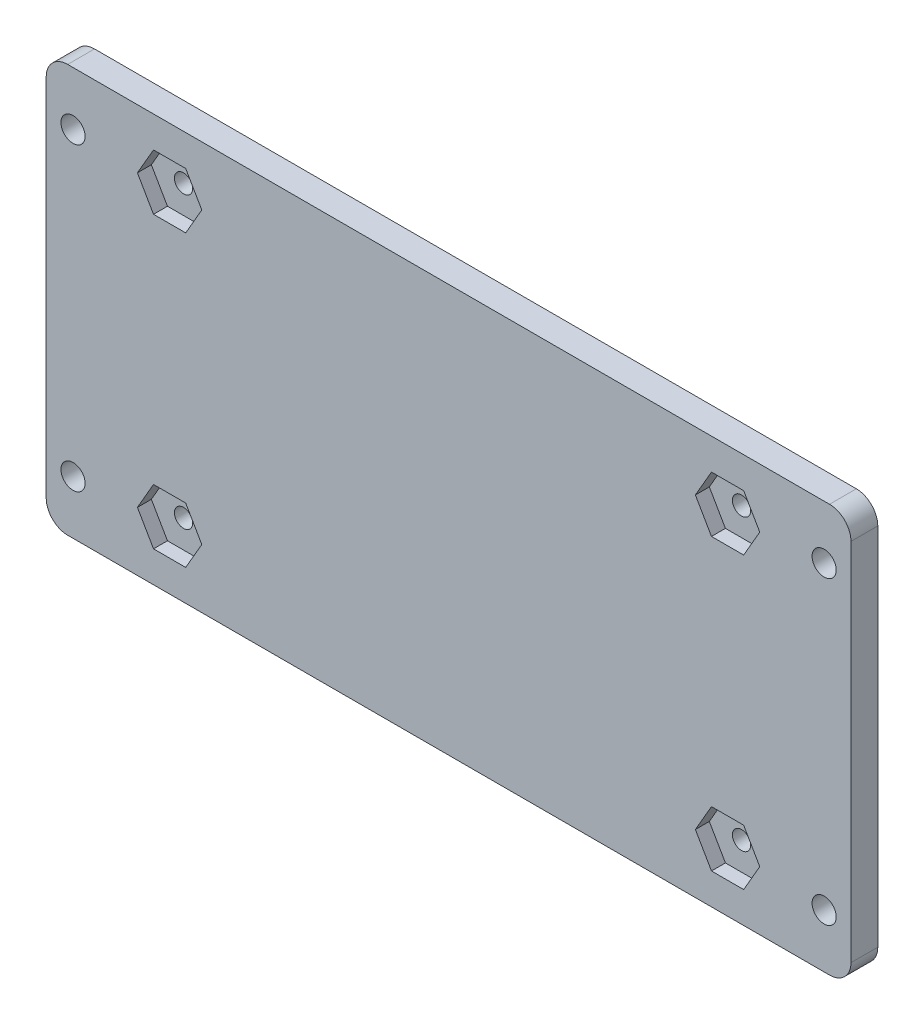
from build123d import *

# Parameters (mm, degrees)
SKETCH1_W               = 150
SKETCH1_H               = 76
BOSS_EXTRUDE1_DEPTH     = 5
FILLET1_R               = 4
SKETCH2_R               = 1.7
CUT_EXTRUDE1_DEPTH      = 85.225886757
CUT_EXTRUDE2_DEPTH      = 2.6
CUT_EXTRUDE3_DEPTH      = 85.225886757
CUT_EXTRUDE3_DEPTH_BACK = 85.225886757
SKETCH4_R               = 2.25


with BuildPart() as part:
    # Sketch1 → Boss-Extrude1 (new body)
    with BuildSketch(Plane.XY):
        Rectangle(SKETCH1_W, SKETCH1_H)
    extrude(amount=BOSS_EXTRUDE1_DEPTH)

    # Fillet1
    fillet1_edges = [part.edges().sort_by_distance(p)[0] for p in [
        (-75, 38, 2.5),
        (75, 38, 2.5),
        (75, -38, 2.5),
        (-75, -38, 2.5),
    ]]
    fillet(fillet1_edges, radius=FILLET1_R)

    # Sketch2 → Cut-Extrude1 (cut, through all)
    with BuildSketch(Plane(origin=(0, 0, 0), x_dir=(-1, 0, 0), z_dir=(0, 0, -1))):
        with Locations((52, -27)):
            Circle(SKETCH2_R)
        with Locations(Location((52, 27, 0), (0, 0, 180))):
            Circle(SKETCH2_R)
        with Locations((-52, 27)):
            Circle(SKETCH2_R)
        with Locations(Location((-52, -27, 0), (0, 0, 180))):
            Circle(SKETCH2_R)
    extrude(amount=-CUT_EXTRUDE1_DEPTH, mode=Mode.SUBTRACT)

    # Sketch3 → Cut-Extrude2 (cut)
    with BuildSketch(Plane.XY.offset(5)):
        Polygon((-49, 21.803847577), (-46, 27), (-49, 32.196152423), (-55, 32.196152423), (-58, 27), (-55, 21.803847577), align=None)
        Polygon((55, 21.803847577), (49, 21.803847577), (46, 27), (49, 32.196152423), (55, 32.196152423), (58, 27), align=None)
        Polygon((49, -21.803847577), (46, -27), (49, -32.196152423), (55, -32.196152423), (58, -27), (55, -21.803847577), align=None)
        Polygon((-55, -21.803847577), (-49, -21.803847577), (-46, -27), (-49, -32.196152423), (-55, -32.196152423), (-58, -27), align=None)
    extrude(amount=-CUT_EXTRUDE2_DEPTH, mode=Mode.SUBTRACT)

    # Sketch4 → Cut-Extrude3 (cut, two sides: drawn at the far end of the back side and taken through both)
    with BuildSketch(Plane.XY.offset(5).offset(-CUT_EXTRUDE3_DEPTH_BACK)):
        with Locations((-70, 28)):
            Circle(SKETCH4_R)
        with Locations((70, 28)):
            Circle(SKETCH4_R)
        with Locations((70, -28)):
            Circle(SKETCH4_R)
        with Locations((-70, -28)):
            Circle(SKETCH4_R)
    extrude(amount=CUT_EXTRUDE3_DEPTH + CUT_EXTRUDE3_DEPTH_BACK, mode=Mode.SUBTRACT)


solid = part.part
